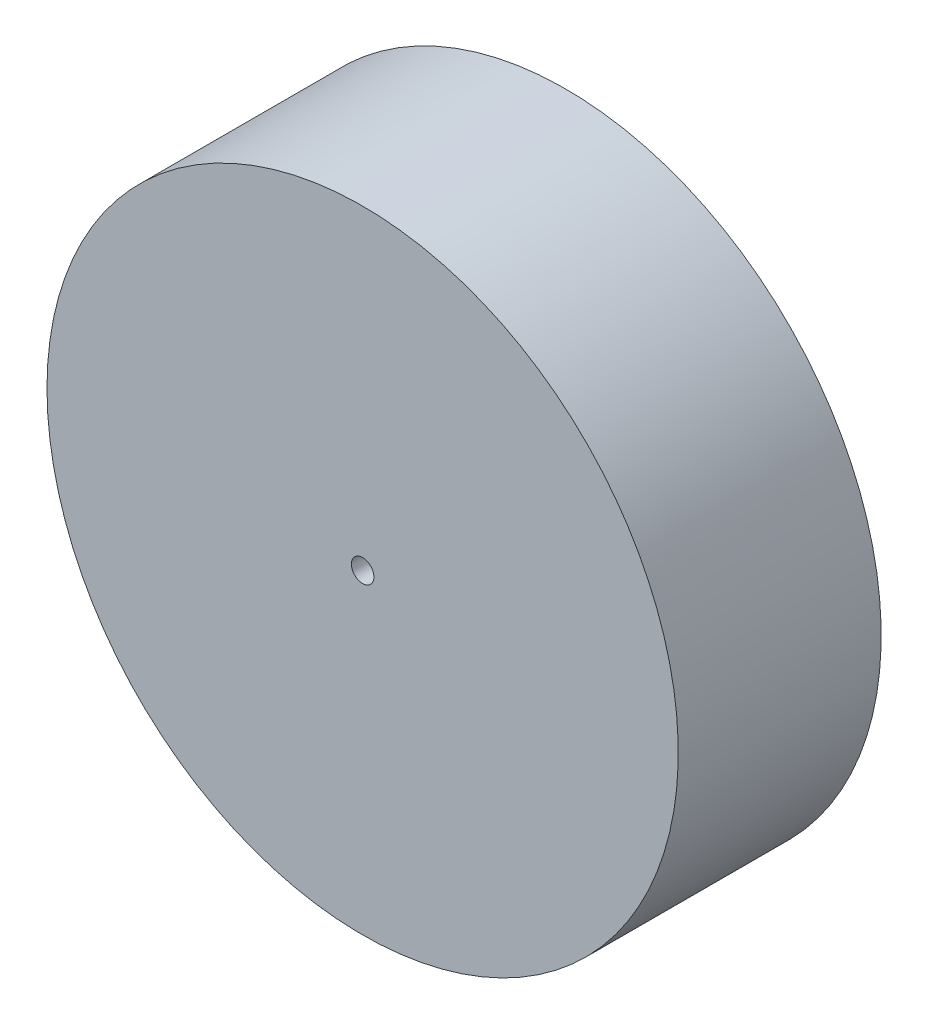
from build123d import *

# Parameters (mm, degrees)
SKETCH1_R               = 70
BOSS_EXTRUDE1_DEPTH     = 45
CUT_EXTRUDE1_DEPTH      = 109.742815855
CUT_EXTRUDE1_DEPTH_BACK = 20
SKETCH2_R               = 2.5


with BuildPart() as part:
    # Sketch1 → Boss-Extrude1 (new body)
    with BuildSketch(Plane.XY):
        with Locations(Location((0, 0, 0), (0, 0, 180))):
            Circle(SKETCH1_R)
    extrude(amount=BOSS_EXTRUDE1_DEPTH)

    # Sketch2 → Cut-Extrude1 (cut, two sides: drawn at the far end of the back side and taken through both)
    with BuildSketch(Plane.XY.offset(45).offset(-CUT_EXTRUDE1_DEPTH_BACK)):
        with Locations(Location((0, 0, 0), (0, 0, 180))):
            Circle(SKETCH2_R)
    extrude(amount=CUT_EXTRUDE1_DEPTH + CUT_EXTRUDE1_DEPTH_BACK, mode=Mode.SUBTRACT)


solid = part.part
